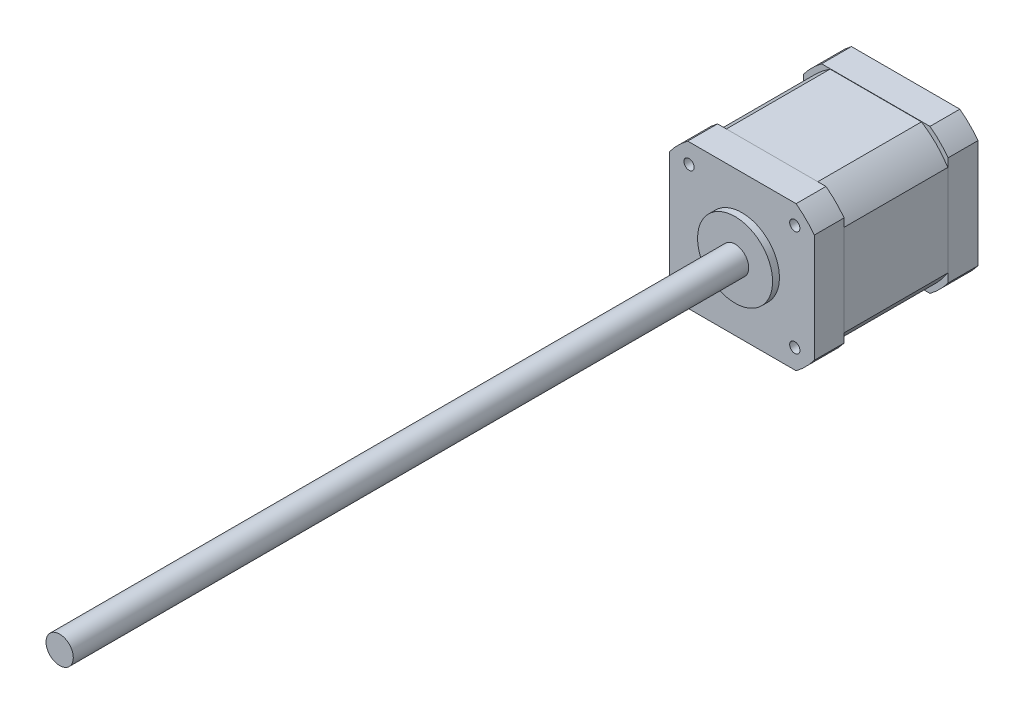
from build123d import *

# Parameters (mm, degrees)
SKETCH1_R                       = 4
BOSS_EXTRUDE1_DEPTH             = 200
SKETCH2_R                       = 11
BOSS_EXTRUDE2_DEPTH             = 2
SKETCH3_W                       = 42.418
SKETCH3_H                       = 42.418
BOSS_EXTRUDE3_DEPTH             = 48
CUT_EXTRUDE1_DEPTH              = 250.80721239
M3X0_5_TAPPED_HOLE1_D           = 2.5
M3X0_5_TAPPED_HOLE1_DEPTH       = 7.5
M3X0_5_TAPPED_HOLE1_CBORE_D     = 3
M3X0_5_TAPPED_HOLE1_CBORE_DEPTH = 6
M3X0_5_TAPPED_HOLE1_TIP         = 0.751075774
CUT_EXTRUDE3_DEPTH              = 15.25


with BuildPart() as part:
    # Sketch1 → Boss-Extrude1 (new body)
    with BuildSketch(Plane.XY):
        Circle(SKETCH1_R)
    extrude(amount=BOSS_EXTRUDE1_DEPTH)

    # Sketch2 → Boss-Extrude2 (add)
    with BuildSketch(Plane(origin=(0, 0, 0), x_dir=(-1, 0, 0), z_dir=(0, 0, -1))):
        Circle(SKETCH2_R)
    extrude(amount=-BOSS_EXTRUDE2_DEPTH)

    # Sketch3 → Boss-Extrude3 (add)
    with BuildSketch(Plane(origin=(0, 0, 0), x_dir=(-1, 0, 0), z_dir=(0, 0, -1))):
        Rectangle(SKETCH3_W, SKETCH3_H)
    extrude(amount=BOSS_EXTRUDE3_DEPTH)

    # Sketch4 → Cut-Extrude1 (cut, through all)
    with BuildSketch(Plane(origin=(0, 0, -48), x_dir=(-1, 0, 0), z_dir=(0, 0, -1))):
        with BuildLine():
            Line((-21.209, -15.887992919), (-21.209, -21.209))
            Line((-21.209, -21.209), (-15.887992919, -21.209))
            ThreePointArc((-15.887992919, -21.209), (-18.738329701, -18.738329701), (-21.209, -15.887992919))
        make_face()
        with BuildLine():
            Line((15.887992919, -21.209), (21.209, -21.209))
            Line((21.209, -21.209), (21.209, -15.887992919))
            ThreePointArc((21.209, -15.887992919), (18.738329701, -18.738329701), (15.887992919, -21.209))
        make_face()
        with BuildLine():
            Line((21.209, 15.887992919), (21.209, 21.209))
            Line((21.209, 21.209), (15.887992919, 21.209))
            ThreePointArc((15.887992919, 21.209), (18.738329701, 18.738329701), (21.209, 15.887992919))
        make_face()
        with BuildLine():
            Line((-15.887992919, 21.209), (-21.209, 21.209))
            Line((-21.209, 21.209), (-21.209, 15.887992919))
            ThreePointArc((-21.209, 15.887992919), (-18.738329701, 18.738329701), (-15.887992919, 21.209))
        make_face()
    extrude(amount=-CUT_EXTRUDE1_DEPTH, mode=Mode.SUBTRACT)

    # M3x0.5 Tapped Hole1
    with Locations(Plane.XY):
        with Locations((-15.5, 15.5), (-15.5, -15.5), (15.5, -15.5), (15.5, 15.5)):
            CounterBoreHole(M3X0_5_TAPPED_HOLE1_D / 2, M3X0_5_TAPPED_HOLE1_CBORE_D / 2, M3X0_5_TAPPED_HOLE1_CBORE_DEPTH, depth=M3X0_5_TAPPED_HOLE1_DEPTH)
            with Locations((0, 0, -(M3X0_5_TAPPED_HOLE1_DEPTH + M3X0_5_TAPPED_HOLE1_TIP / 2))):  # 118° drill point
                Cone(0, M3X0_5_TAPPED_HOLE1_D / 2, M3X0_5_TAPPED_HOLE1_TIP, mode=Mode.SUBTRACT)

    # Sketch8 → Cut-Extrude3 (cut, symmetric)
    with BuildSketch(Plane.XY.offset(-24)):
        with BuildLine():
            Line((15.887992919, 21.209), (-15.887992919, 21.209))
            ThreePointArc((-15.887992919, 21.209), (-18.738329701, 18.738329701), (-21.209, 15.887992919))
            Line((-21.209, 15.887992919), (-21.209, -15.887992919))
            ThreePointArc((-21.209, -15.887992919), (-18.738329701, -18.738329701), (-15.887992919, -21.209))
            Line((-15.887992919, -21.209), (15.887992919, -21.209))
            ThreePointArc((15.887992919, -21.209), (18.738329701, -18.738329701), (21.209, -15.887992919))
            Line((21.209, -15.887992919), (21.209, 15.887992919))
            ThreePointArc((21.209, 15.887992919), (18.738329701, 18.738329701), (15.887992919, 21.209))
        make_face()
        with BuildLine():
            Line((-13.394406258, 21.109), (13.394406258, 21.109))
            ThreePointArc((13.394406258, 21.109), (17.67766953, 17.67766953), (21.109, 13.394406258))
            Line((21.109, 13.394406258), (21.109, -13.394406258))
            ThreePointArc((21.109, -13.394406258), (17.67766953, -17.67766953), (13.394406258, -21.109))
            Line((13.394406258, -21.109), (-13.394406258, -21.109))
            ThreePointArc((-13.394406258, -21.109), (-17.67766953, -17.67766953), (-21.109, -13.394406258))
            Line((-21.109, -13.394406258), (-21.109, 13.394406258))
            ThreePointArc((-21.109, 13.394406258), (-17.67766953, 17.67766953), (-13.394406258, 21.109))
        make_face(mode=Mode.SUBTRACT)
    extrude(amount=CUT_EXTRUDE3_DEPTH, both=True, mode=Mode.SUBTRACT)


solid = part.part
